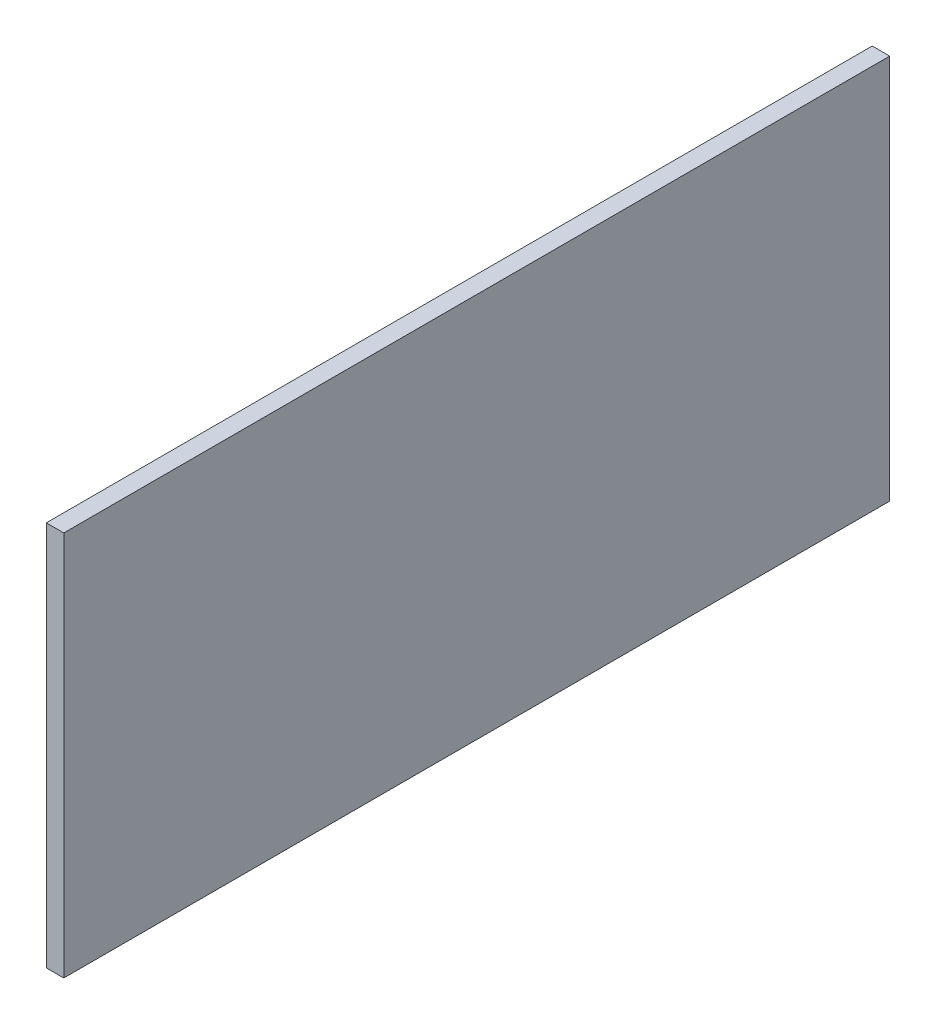
from build123d import *

# Parameters (mm, degrees)
SKETCH1_W           = 150
SKETCH1_H           = 70
BOSS_EXTRUDE1_DEPTH = 3.175


with BuildPart() as part:
    # Sketch1 → Boss-Extrude1 (new body)
    with BuildSketch(Plane(origin=(0, 0, 0), x_dir=(0, 0, -1), z_dir=(1, 0, 0))):
        with Locations((75, 35)):
            Rectangle(SKETCH1_W, SKETCH1_H)
    extrude(amount=BOSS_EXTRUDE1_DEPTH)


solid = part.part
